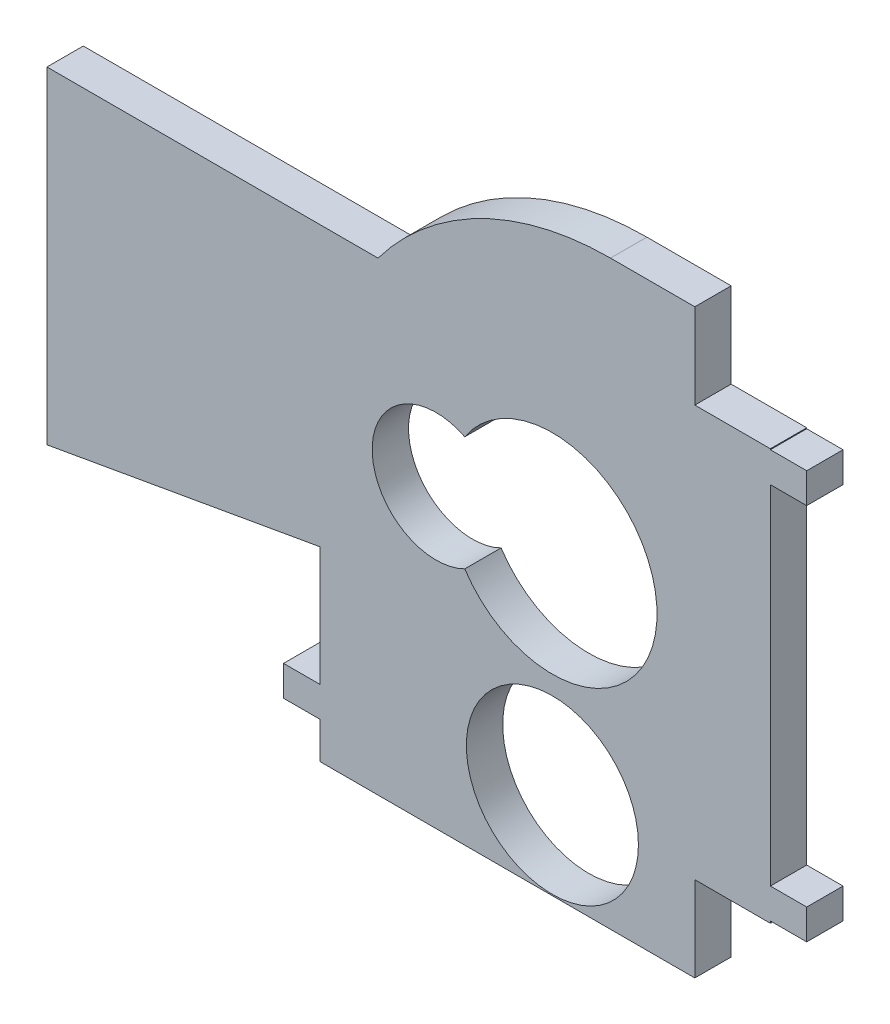
from build123d import *

# Parameters (mm, degrees)
SKETCH1_R           = 3.7592
SKETCH1_W           = 1.5875
SKETCH1_H           = 1.3208
BOSS_EXTRUDE1_DEPTH = 1.5875
CUT_EXTRUDE1_REACH  = 32.926


with BuildPart() as part:
    # Sketch1 → Boss-Extrude1 (new body)
    # profile 1 of 6: a face of its own
    with BuildSketch(Plane.XY):
        with BuildLine():
            Line((2.54, 21.59), (9.525, 21.59))
            Line((9.525, 21.59), (9.525, -3.81))
            Line((9.525, -3.81), (-10.16, -3.81))
            Line((-10.16, -3.81), (-10.16, 8.89))
            ThreePointArc((-10.16, 8.89), (-6.440256121, 17.870256121), (2.54, 21.59))
        make_face()
        Circle(SKETCH1_R, mode=Mode.SUBTRACT)
        with BuildLine():
            ThreePointArc((-3.82905, 11.642311449), (-7.874, 9.144), (-3.82905, 6.645688551))
            ThreePointArc((-3.82905, 6.645688551), (4.572, 9.144), (-3.82905, 11.642311449))
        make_face(mode=Mode.SUBTRACT)
    # profile 2 of 6: a face of its own
    with BuildSketch(Plane.XY):
        with Locations((-10.95375, -1.5494)):
            Rectangle(SKETCH1_W, SKETCH1_H)
    # profile 3 of 6: a face of its own
    with BuildSketch(Plane.XY):
        with Locations((10.31875, 17.1704)):
            Rectangle(SKETCH1_W, SKETCH1_H)
    # profile 4 of 6: a face of its own
    with BuildSketch(Plane.XY):
        with Locations((10.31875, 0.6604)):
            Rectangle(SKETCH1_W, SKETCH1_H)
    # profile 5 of 6: a face of its own
    with BuildSketch(Plane.XY):
        with BuildLine():
            ThreePointArc((-10.16, 8.89), (-9.508277885, 12.906092628), (-7.62, 16.51))
            Line((-7.62, 16.51), (-22.084921519, 16.51))
            Line((-22.084921519, 16.51), (-22.084921519, 2.212007412))
            Line((-22.084921519, 2.212007412), (-10.16, 4.318))
            Line((-10.16, 4.318), (-10.16, 8.89))
        make_face()
    # profile 6 of 6: a face of its own
    with BuildSketch(Plane.XY):
        with BuildLine():
            ThreePointArc((-10.16, 8.89), (-9.508277885, 12.906092628), (-7.62, 16.51))
            Line((-7.62, 16.51), (-22.084921519, 16.51))
            Line((-22.084921519, 16.51), (-22.084921519, 2.212007412))
            Line((-22.084921519, 2.212007412), (-10.16, 4.318))
            Line((-10.16, 4.318), (-10.16, 8.89))
        make_face()
    extrude(amount=BOSS_EXTRUDE1_DEPTH)

    # Sketch2 → Cut-Extrude1 (cut, up to next)
    with BuildSketch(Plane.XY.offset(1.5875), mode=Mode.PRIVATE) as cut_extrude1_sk1:
        Polygon((6.223, -0.0889), (6.223, -3.81), (9.525, -3.81), (9.525, -3.0226), (9.525, -0.9144), (9.525, -0.0889), align=None)
    cut_extrude1_tool1 = extrude(cut_extrude1_sk1.sketch, amount=-CUT_EXTRUDE1_REACH, mode=Mode.PRIVATE) & part.part
    # Sketch2 → Cut-Extrude1 (cut, up to next)
    with BuildSketch(Plane.XY.offset(1.5875), mode=Mode.PRIVATE) as cut_extrude1_sk2:
        Polygon((9.525, 18.6944), (9.525, 20.8026), (9.525, 21.59), (6.223, 21.59), (6.223, 17.8689), (9.525, 17.8689), align=None)
    cut_extrude1_tool2 = extrude(cut_extrude1_sk2.sketch, amount=-CUT_EXTRUDE1_REACH, mode=Mode.PRIVATE) & part.part
    add(cut_extrude1_tool1.solids().sort_by_distance((7.874, -1.94945, 1.5875))[0], mode=Mode.SUBTRACT)
    add(cut_extrude1_tool2.solids().sort_by_distance((7.874, 19.72945, 1.5875))[0], mode=Mode.SUBTRACT)


solid = part.part
